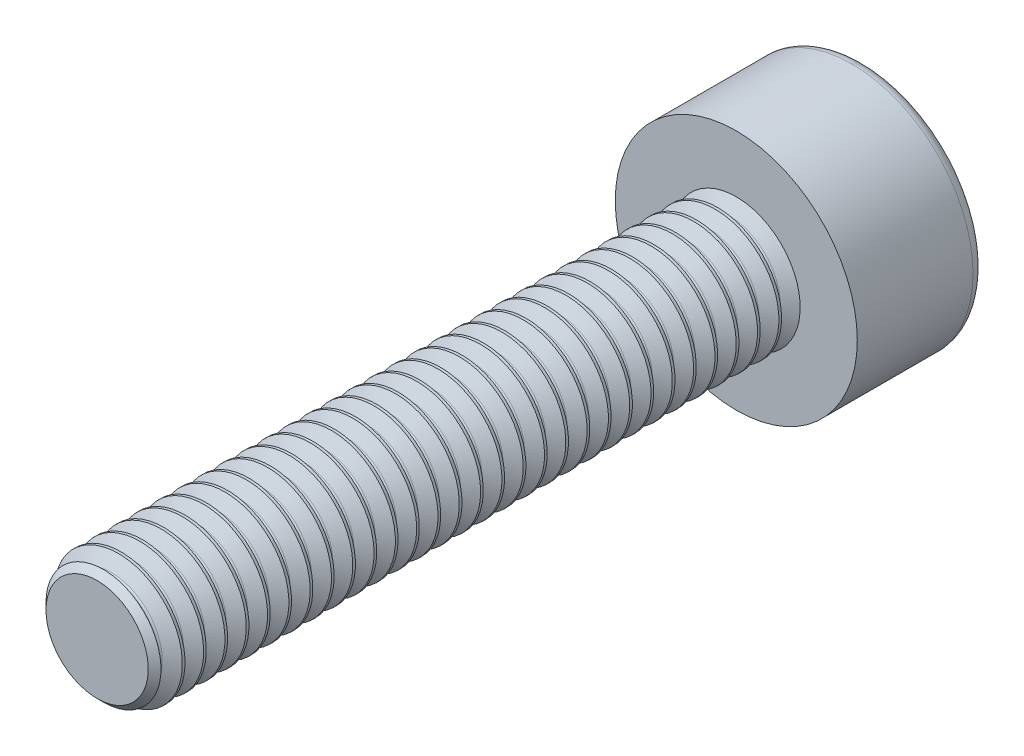
from build123d import *

# Parameters (mm, degrees)
CUT_EXTRUDE1_DEPTH = 1.5
FILLET1_R          = 0.284


with BuildPart() as part:
    # Sketch1 → Revolve1 (revolve)
    with BuildSketch(Plane.XZ, mode=Mode.PRIVATE) as revolve1_sk:
        with BuildLine():
            Line((1.2, 14.999999999), (0, 14.999999999))
            Line((0, 14.999999999), (0, -3.000000001))
            Line((0, -3.000000001), (2.84, -3.000000001))
            Line((2.84, -3.000000001), (2.84, 0))
            Line((2.84, 0), (1.5, 0))
            Line((1.5, 0), (1.202303768, 0.171875))
            add(Edge.make_bspline(
                [(1.175240473, 0.21875), (1.175240473, 0.200707804), (1.186678768, 0.180896098), (1.202303768, 0.171875)],
                knots=[0, 0, 0, 0, 1, 1, 1, 1], degree=3))
            add(Edge.make_bspline(
                [(1.202303767, 0.265625), (1.186678767, 0.256603902), (1.175240473, 0.236792196), (1.175240473, 0.21875)],
                knots=[0, 0, 0, 0, 1, 1, 1, 1], degree=3))
            Line((1.202303767, 0.265625), (1.5, 0.4375))
            Line((1.5, 0.4375), (1.5, 0.5))
            Line((1.5, 0.5), (1.202303767, 0.671875))
            add(Edge.make_bspline(
                [(1.202303767, 0.671875), (1.186678767, 0.680896098), (1.175240473, 0.700707804), (1.175240473, 0.71875)],
                knots=[0, 0, 0, 0, 1, 1, 1, 1], degree=3))
            add(Edge.make_bspline(
                [(1.175240473, 0.71875), (1.175240473, 0.736792196), (1.186678767, 0.756603902), (1.202303767, 0.765625)],
                knots=[0, 0, 0, 0, 1, 1, 1, 1], degree=3))
            Line((1.202303767, 0.765625), (1.5, 0.9375))
            Line((1.5, 0.9375), (1.5, 1))
            Line((1.5, 1), (1.202303767, 1.171875))
            add(Edge.make_bspline(
                [(1.202303767, 1.171875), (1.186678767, 1.180896098), (1.175240473, 1.200707804), (1.175240473, 1.21875)],
                knots=[0, 0, 0, 0, 1, 1, 1, 1], degree=3))
            add(Edge.make_bspline(
                [(1.175240473, 1.21875), (1.175240473, 1.236792196), (1.186678767, 1.256603902), (1.202303767, 1.265625)],
                knots=[0, 0, 0, 0, 1, 1, 1, 1], degree=3))
            Line((1.202303767, 1.265625), (1.5, 1.4375))
            Line((1.5, 1.4375), (1.5, 1.5))
            Line((1.5, 1.5), (1.202303767, 1.671875))
            add(Edge.make_bspline(
                [(1.202303767, 1.671875), (1.186678767, 1.680896098), (1.175240473, 1.700707804), (1.175240473, 1.71875)],
                knots=[0, 0, 0, 0, 1, 1, 1, 1], degree=3))
            add(Edge.make_bspline(
                [(1.175240473, 1.71875), (1.175240473, 1.736792196), (1.186678767, 1.756603902), (1.202303767, 1.765625)],
                knots=[0, 0, 0, 0, 1, 1, 1, 1], degree=3))
            Line((1.202303767, 1.765625), (1.5, 1.9375))
            Line((1.5, 1.9375), (1.5, 2))
            Line((1.5, 2), (1.202303767, 2.171875))
            add(Edge.make_bspline(
                [(1.202303767, 2.171875), (1.186678767, 2.180896098), (1.175240473, 2.200707804), (1.175240473, 2.21875)],
                knots=[0, 0, 0, 0, 1, 1, 1, 1], degree=3))
            add(Edge.make_bspline(
                [(1.175240473, 2.21875), (1.175240473, 2.236792196), (1.186678767, 2.256603902), (1.202303767, 2.265625)],
                knots=[0, 0, 0, 0, 1, 1, 1, 1], degree=3))
            Line((1.202303767, 2.265625), (1.5, 2.4375))
            Line((1.5, 2.4375), (1.5, 2.5))
            Line((1.5, 2.5), (1.202303767, 2.671875))
            add(Edge.make_bspline(
                [(1.202303767, 2.671875), (1.186678767, 2.680896098), (1.175240473, 2.700707804), (1.175240473, 2.71875)],
                knots=[0, 0, 0, 0, 1, 1, 1, 1], degree=3))
            add(Edge.make_bspline(
                [(1.175240473, 2.71875), (1.175240473, 2.736792196), (1.186678767, 2.756603902), (1.202303767, 2.765625)],
                knots=[0, 0, 0, 0, 1, 1, 1, 1], degree=3))
            Line((1.202303767, 2.765625), (1.5, 2.9375))
            Line((1.5, 2.9375), (1.5, 3))
            Line((1.5, 3), (1.202303767, 3.171875))
            add(Edge.make_bspline(
                [(1.202303767, 3.171875), (1.186678767, 3.180896098), (1.175240473, 3.200707804), (1.175240473, 3.21875)],
                knots=[0, 0, 0, 0, 1, 1, 1, 1], degree=3))
            add(Edge.make_bspline(
                [(1.175240473, 3.21875), (1.175240473, 3.236792196), (1.186678767, 3.256603902), (1.202303767, 3.265625)],
                knots=[0, 0, 0, 0, 1, 1, 1, 1], degree=3))
            Line((1.202303767, 3.265625), (1.5, 3.4375))
            Line((1.5, 3.4375), (1.5, 3.5))
            Line((1.5, 3.5), (1.202303767, 3.671875))
            add(Edge.make_bspline(
                [(1.202303767, 3.671875), (1.186678767, 3.680896098), (1.175240473, 3.700707804), (1.175240473, 3.71875)],
                knots=[0, 0, 0, 0, 1, 1, 1, 1], degree=3))
            add(Edge.make_bspline(
                [(1.175240473, 3.71875), (1.175240473, 3.736792196), (1.186678767, 3.756603902), (1.202303767, 3.765625)],
                knots=[0, 0, 0, 0, 1, 1, 1, 1], degree=3))
            Line((1.202303767, 3.765625), (1.5, 3.9375))
            Line((1.5, 3.9375), (1.5, 4))
            Line((1.5, 4), (1.202303767, 4.171875))
            add(Edge.make_bspline(
                [(1.202303767, 4.171875), (1.186678767, 4.180896098), (1.175240473, 4.200707804), (1.175240473, 4.21875)],
                knots=[0, 0, 0, 0, 1, 1, 1, 1], degree=3))
            add(Edge.make_bspline(
                [(1.175240473, 4.21875), (1.175240473, 4.236792196), (1.186678767, 4.256603902), (1.202303767, 4.265625)],
                knots=[0, 0, 0, 0, 1, 1, 1, 1], degree=3))
            Line((1.202303767, 4.265625), (1.5, 4.4375))
            Line((1.5, 4.4375), (1.5, 4.5))
            Line((1.5, 4.5), (1.202303767, 4.671875))
            add(Edge.make_bspline(
                [(1.202303767, 4.671875), (1.186678767, 4.680896098), (1.175240473, 4.700707804), (1.175240473, 4.71875)],
                knots=[0, 0, 0, 0, 1, 1, 1, 1], degree=3))
            add(Edge.make_bspline(
                [(1.175240473, 4.71875), (1.175240473, 4.736792196), (1.186678767, 4.756603902), (1.202303767, 4.765625)],
                knots=[0, 0, 0, 0, 1, 1, 1, 1], degree=3))
            Line((1.202303767, 4.765625), (1.5, 4.9375))
            Line((1.5, 4.9375), (1.5, 5))
            Line((1.5, 5), (1.202303767, 5.171875))
            add(Edge.make_bspline(
                [(1.202303767, 5.171875), (1.186678767, 5.180896098), (1.175240473, 5.200707804), (1.175240473, 5.21875)],
                knots=[0, 0, 0, 0, 1, 1, 1, 1], degree=3))
            add(Edge.make_bspline(
                [(1.175240473, 5.21875), (1.175240473, 5.236792196), (1.186678767, 5.256603902), (1.202303767, 5.265625)],
                knots=[0, 0, 0, 0, 1, 1, 1, 1], degree=3))
            Line((1.202303767, 5.265625), (1.5, 5.4375))
            Line((1.5, 5.4375), (1.5, 5.5))
            Line((1.5, 5.5), (1.202303767, 5.671875))
            add(Edge.make_bspline(
                [(1.202303767, 5.671875), (1.186678767, 5.680896098), (1.175240473, 5.700707804), (1.175240473, 5.71875)],
                knots=[0, 0, 0, 0, 1, 1, 1, 1], degree=3))
            add(Edge.make_bspline(
                [(1.175240473, 5.71875), (1.175240473, 5.736792196), (1.186678767, 5.756603902), (1.202303767, 5.765625)],
                knots=[0, 0, 0, 0, 1, 1, 1, 1], degree=3))
            Line((1.202303767, 5.765625), (1.5, 5.9375))
            Line((1.5, 5.9375), (1.5, 6))
            Line((1.5, 6), (1.202303767, 6.171875))
            add(Edge.make_bspline(
                [(1.202303767, 6.171875), (1.186678767, 6.180896098), (1.175240473, 6.200707804), (1.175240473, 6.21875)],
                knots=[0, 0, 0, 0, 1, 1, 1, 1], degree=3))
            add(Edge.make_bspline(
                [(1.175240473, 6.21875), (1.175240473, 6.236792196), (1.186678767, 6.256603902), (1.202303767, 6.265625)],
                knots=[0, 0, 0, 0, 1, 1, 1, 1], degree=3))
            Line((1.202303767, 6.265625), (1.5, 6.4375))
            Line((1.5, 6.4375), (1.5, 6.5))
            Line((1.5, 6.5), (1.202303767, 6.671875))
            add(Edge.make_bspline(
                [(1.202303767, 6.671875), (1.186678767, 6.680896098), (1.175240473, 6.700707804), (1.175240473, 6.71875)],
                knots=[0, 0, 0, 0, 1, 1, 1, 1], degree=3))
            add(Edge.make_bspline(
                [(1.175240473, 6.71875), (1.175240473, 6.736792196), (1.186678767, 6.756603902), (1.202303767, 6.765625)],
                knots=[0, 0, 0, 0, 1, 1, 1, 1], degree=3))
            Line((1.202303767, 6.765625), (1.5, 6.9375))
            Line((1.5, 6.9375), (1.5, 7))
            Line((1.5, 7), (1.202303767, 7.171875))
            add(Edge.make_bspline(
                [(1.202303767, 7.171875), (1.186678767, 7.180896098), (1.175240473, 7.200707804), (1.175240473, 7.21875)],
                knots=[0, 0, 0, 0, 1, 1, 1, 1], degree=3))
            add(Edge.make_bspline(
                [(1.175240473, 7.21875), (1.175240473, 7.236792196), (1.186678767, 7.256603902), (1.202303767, 7.265625)],
                knots=[0, 0, 0, 0, 1, 1, 1, 1], degree=3))
            Line((1.202303767, 7.265625), (1.5, 7.4375))
            Line((1.5, 7.4375), (1.5, 7.5))
            Line((1.5, 7.5), (1.202303767, 7.671875))
            add(Edge.make_bspline(
                [(1.202303767, 7.671875), (1.186678767, 7.680896098), (1.175240473, 7.700707804), (1.175240473, 7.71875)],
                knots=[0, 0, 0, 0, 1, 1, 1, 1], degree=3))
            add(Edge.make_bspline(
                [(1.175240473, 7.71875), (1.175240473, 7.736792196), (1.186678767, 7.756603902), (1.202303767, 7.765625)],
                knots=[0, 0, 0, 0, 1, 1, 1, 1], degree=3))
            Line((1.202303767, 7.765625), (1.5, 7.9375))
            Line((1.5, 7.9375), (1.5, 8))
            Line((1.5, 8), (1.202303767, 8.171875))
            add(Edge.make_bspline(
                [(1.202303767, 8.171875), (1.186678767, 8.180896098), (1.175240473, 8.200707804), (1.175240473, 8.21875)],
                knots=[0, 0, 0, 0, 1, 1, 1, 1], degree=3))
            add(Edge.make_bspline(
                [(1.175240473, 8.21875), (1.175240473, 8.236792196), (1.186678767, 8.256603902), (1.202303767, 8.265625)],
                knots=[0, 0, 0, 0, 1, 1, 1, 1], degree=3))
            Line((1.202303767, 8.265625), (1.5, 8.4375))
            Line((1.5, 8.4375), (1.5, 8.5))
            Line((1.5, 8.5), (1.202303767, 8.671875))
            add(Edge.make_bspline(
                [(1.202303767, 8.671875), (1.186678767, 8.680896098), (1.175240473, 8.700707804), (1.175240473, 8.71875)],
                knots=[0, 0, 0, 0, 1, 1, 1, 1], degree=3))
            add(Edge.make_bspline(
                [(1.175240473, 8.71875), (1.175240473, 8.736792196), (1.186678767, 8.756603902), (1.202303767, 8.765625)],
                knots=[0, 0, 0, 0, 1, 1, 1, 1], degree=3))
            Line((1.202303767, 8.765625), (1.5, 8.9375))
            Line((1.5, 8.9375), (1.5, 9))
            Line((1.5, 9), (1.202303767, 9.171875))
            add(Edge.make_bspline(
                [(1.202303767, 9.171875), (1.186678767, 9.180896098), (1.175240473, 9.200707804), (1.175240473, 9.21875)],
                knots=[0, 0, 0, 0, 1, 1, 1, 1], degree=3))
            add(Edge.make_bspline(
                [(1.175240473, 9.21875), (1.175240473, 9.236792196), (1.186678767, 9.256603902), (1.202303767, 9.265625)],
                knots=[0, 0, 0, 0, 1, 1, 1, 1], degree=3))
            Line((1.202303767, 9.265625), (1.5, 9.4375))
            Line((1.5, 9.4375), (1.5, 9.5))
            Line((1.5, 9.5), (1.202303767, 9.671875))
            add(Edge.make_bspline(
                [(1.202303767, 9.671875), (1.186678767, 9.680896098), (1.175240473, 9.700707804), (1.175240473, 9.71875)],
                knots=[0, 0, 0, 0, 1, 1, 1, 1], degree=3))
            add(Edge.make_bspline(
                [(1.175240473, 9.71875), (1.175240473, 9.736792196), (1.186678767, 9.756603902), (1.202303767, 9.765625)],
                knots=[0, 0, 0, 0, 1, 1, 1, 1], degree=3))
            Line((1.202303767, 9.765625), (1.5, 9.9375))
            Line((1.5, 9.9375), (1.5, 10))
            Line((1.5, 10), (1.202303767, 10.171875))
            add(Edge.make_bspline(
                [(1.202303767, 10.171875), (1.186678767, 10.180896098), (1.175240473, 10.200707804), (1.175240473, 10.21875)],
                knots=[0, 0, 0, 0, 1, 1, 1, 1], degree=3))
            add(Edge.make_bspline(
                [(1.175240473, 10.21875), (1.175240473, 10.236792196), (1.186678767, 10.256603902), (1.202303767, 10.265625)],
                knots=[0, 0, 0, 0, 1, 1, 1, 1], degree=3))
            Line((1.202303767, 10.265625), (1.5, 10.4375))
            Line((1.5, 10.4375), (1.5, 10.5))
            Line((1.5, 10.5), (1.202303767, 10.671875))
            add(Edge.make_bspline(
                [(1.202303767, 10.671875), (1.186678767, 10.680896098), (1.175240473, 10.700707804), (1.175240473, 10.71875)],
                knots=[0, 0, 0, 0, 1, 1, 1, 1], degree=3))
            add(Edge.make_bspline(
                [(1.175240473, 10.71875), (1.175240473, 10.736792196), (1.186678767, 10.756603902), (1.202303767, 10.765625)],
                knots=[0, 0, 0, 0, 1, 1, 1, 1], degree=3))
            Line((1.202303767, 10.765625), (1.5, 10.9375))
            Line((1.5, 10.9375), (1.5, 11))
            Line((1.5, 11), (1.202303767, 11.171875))
            add(Edge.make_bspline(
                [(1.202303767, 11.171875), (1.186678767, 11.180896098), (1.175240473, 11.200707804), (1.175240473, 11.21875)],
                knots=[0, 0, 0, 0, 1, 1, 1, 1], degree=3))
            add(Edge.make_bspline(
                [(1.175240473, 11.21875), (1.175240473, 11.236792196), (1.186678767, 11.256603902), (1.202303767, 11.265625)],
                knots=[0, 0, 0, 0, 1, 1, 1, 1], degree=3))
            Line((1.202303767, 11.265625), (1.5, 11.4375))
            Line((1.5, 11.4375), (1.5, 11.5))
            Line((1.5, 11.5), (1.202303767, 11.671875))
            add(Edge.make_bspline(
                [(1.202303767, 11.671875), (1.186678767, 11.680896098), (1.175240473, 11.700707804), (1.175240473, 11.71875)],
                knots=[0, 0, 0, 0, 1, 1, 1, 1], degree=3))
            add(Edge.make_bspline(
                [(1.175240473, 11.71875), (1.175240473, 11.736792196), (1.186678767, 11.756603902), (1.202303767, 11.765625)],
                knots=[0, 0, 0, 0, 1, 1, 1, 1], degree=3))
            Line((1.202303767, 11.765625), (1.5, 11.9375))
            Line((1.5, 11.9375), (1.5, 12))
            Line((1.5, 12), (1.202303767, 12.171875))
            add(Edge.make_bspline(
                [(1.202303767, 12.171875), (1.186678767, 12.180896098), (1.175240473, 12.200707804), (1.175240473, 12.21875)],
                knots=[0, 0, 0, 0, 1, 1, 1, 1], degree=3))
            add(Edge.make_bspline(
                [(1.175240473, 12.21875), (1.175240473, 12.236792196), (1.186678767, 12.256603902), (1.202303767, 12.265625)],
                knots=[0, 0, 0, 0, 1, 1, 1, 1], degree=3))
            Line((1.202303767, 12.265625), (1.5, 12.4375))
            Line((1.5, 12.4375), (1.5, 12.5))
            Line((1.5, 12.5), (1.202303767, 12.671875))
            add(Edge.make_bspline(
                [(1.202303767, 12.671875), (1.186678767, 12.680896098), (1.175240473, 12.700707804), (1.175240473, 12.71875)],
                knots=[0, 0, 0, 0, 1, 1, 1, 1], degree=3))
            add(Edge.make_bspline(
                [(1.175240473, 12.71875), (1.175240473, 12.736792196), (1.186678767, 12.756603902), (1.202303767, 12.765625)],
                knots=[0, 0, 0, 0, 1, 1, 1, 1], degree=3))
            Line((1.202303767, 12.765625), (1.5, 12.9375))
            Line((1.5, 12.9375), (1.5, 13))
            Line((1.5, 13), (1.202303767, 13.171875))
            add(Edge.make_bspline(
                [(1.202303767, 13.171875), (1.186678767, 13.180896098), (1.175240473, 13.200707804), (1.175240473, 13.21875)],
                knots=[0, 0, 0, 0, 1, 1, 1, 1], degree=3))
            add(Edge.make_bspline(
                [(1.175240473, 13.21875), (1.175240473, 13.236792196), (1.186678767, 13.256603902), (1.202303767, 13.265625)],
                knots=[0, 0, 0, 0, 1, 1, 1, 1], degree=3))
            Line((1.202303767, 13.265625), (1.5, 13.4375))
            Line((1.5, 13.4375), (1.5, 13.5))
            Line((1.5, 13.5), (1.202303767, 13.671875))
            add(Edge.make_bspline(
                [(1.202303767, 13.671875), (1.186678767, 13.680896098), (1.175240473, 13.700707804), (1.175240473, 13.71875)],
                knots=[0, 0, 0, 0, 1, 1, 1, 1], degree=3))
            add(Edge.make_bspline(
                [(1.175240473, 13.71875), (1.175240473, 13.736792196), (1.186678767, 13.756603902), (1.202303767, 13.765625)],
                knots=[0, 0, 0, 0, 1, 1, 1, 1], degree=3))
            Line((1.202303767, 13.765625), (1.5, 13.9375))
            Line((1.5, 13.9375), (1.5, 14))
            Line((1.5, 14), (1.202303767, 14.171875))
            add(Edge.make_bspline(
                [(1.202303767, 14.171875), (1.186678767, 14.180896098), (1.175240473, 14.200707804), (1.175240473, 14.21875)],
                knots=[0, 0, 0, 0, 1, 1, 1, 1], degree=3))
            add(Edge.make_bspline(
                [(1.175240473, 14.21875), (1.175240473, 14.236792196), (1.186678767, 14.256603902), (1.202303767, 14.265625)],
                knots=[0, 0, 0, 0, 1, 1, 1, 1], degree=3))
            Line((1.202303767, 14.265625), (1.5, 14.4375))
            Line((1.5, 14.4375), (1.5, 14.5))
            Line((1.5, 14.5), (1.202303768, 14.671875))
            add(Edge.make_bspline(
                [(1.175240473, 14.718749999), (1.175240473, 14.700707803), (1.186678768, 14.680896097), (1.202303768, 14.671875)],
                knots=[0, 0, 0, 0, 1, 1, 1, 1], degree=3))
            add(Edge.make_bspline(
                [(1.202303767, 14.765624999), (1.186678767, 14.756603901), (1.175240473, 14.736792195), (1.175240473, 14.718749999)],
                knots=[0, 0, 0, 0, 1, 1, 1, 1], degree=3))
            Line((1.202303767, 14.765624999), (1.349431033, 14.850568966))
            Line((1.349431033, 14.850568966), (1.2, 14.999999999))
        make_face()
    revolve(revolve1_sk.sketch.rotate(Axis((0, 0, 14.999999999), (0, 0, -1)), 180), axis=Axis((0, 0, 14.999999999), (0, 0, -1)))

    # Sketch2 → Cut-Extrude1 (cut)
    with BuildSketch(Plane(origin=(0, 0, -3.000000001), x_dir=(-1, 0, 0), z_dir=(0, 0, -1))):
        Polygon((-1.443375673, 0), (-0.721687837, -1.25), (0.721687836, -1.25), (1.443375672, 0), (0.721687836, 1.25), (-0.721687837, 1.25), align=None)
    extrude(amount=-CUT_EXTRUDE1_DEPTH, mode=Mode.SUBTRACT)

    # Fillet1
    fillet1_edges = [part.edges().sort_by_distance(p)[0] for p in [
        (2.84, 0, -3.000000001),
    ]]
    fillet(fillet1_edges, radius=FILLET1_R)


solid = part.part
